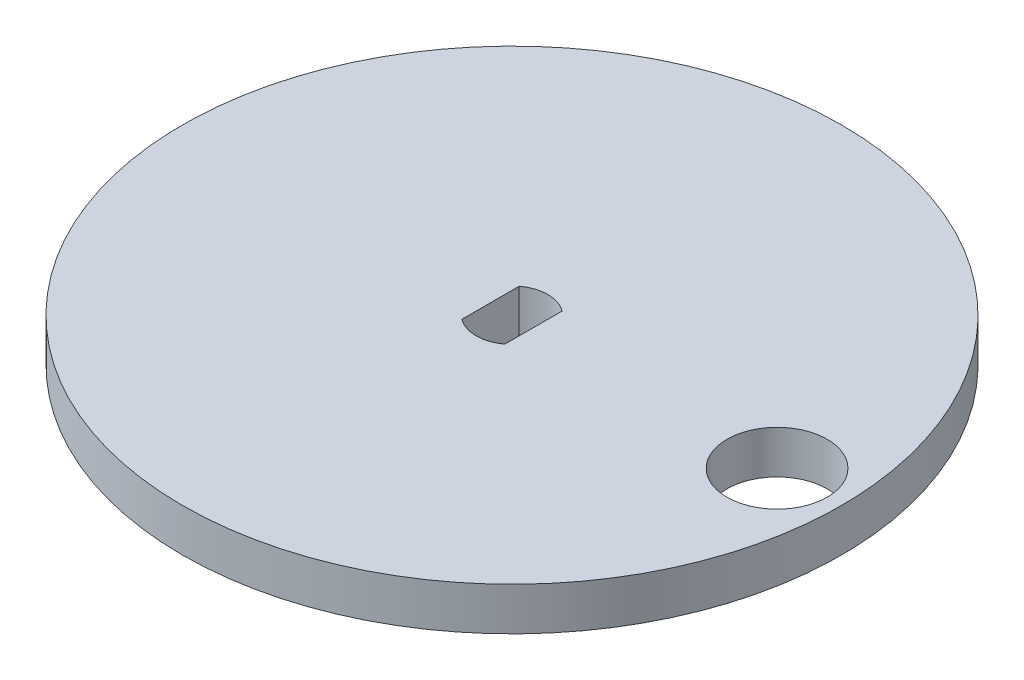
from build123d import *

# Parameters (mm, degrees)
CROQUIS1_R              = 23
CROQUIS1_R_2            = 3.5
SALIENTE_EXTRUIR1_DEPTH = 3


with BuildPart() as part:
    # Croquis1 → Saliente-Extruir1 (new body)
    with BuildSketch(Plane(origin=(0, 0, 0), x_dir=(1, 0, 0), z_dir=(0, 1, 0))):
        with Locations(Location((0, 0, 0), (0, 0, 270))):
            Circle(CROQUIS1_R)
        with BuildLine():
            Line((1.5, 2), (1.5, -2))
            ThreePointArc((1.5, -2), (0, -2.5), (-1.5, -2))
            Line((-1.5, -2), (-1.5, 2))
            ThreePointArc((-1.5, 2), (0, 2.5), (1.5, 2))
        make_face(mode=Mode.SUBTRACT)
        with Locations(Location((18.5, 0, 0), (0, 0, 270))):
            Circle(CROQUIS1_R_2, mode=Mode.SUBTRACT)
    extrude(amount=SALIENTE_EXTRUIR1_DEPTH)


solid = part.part
